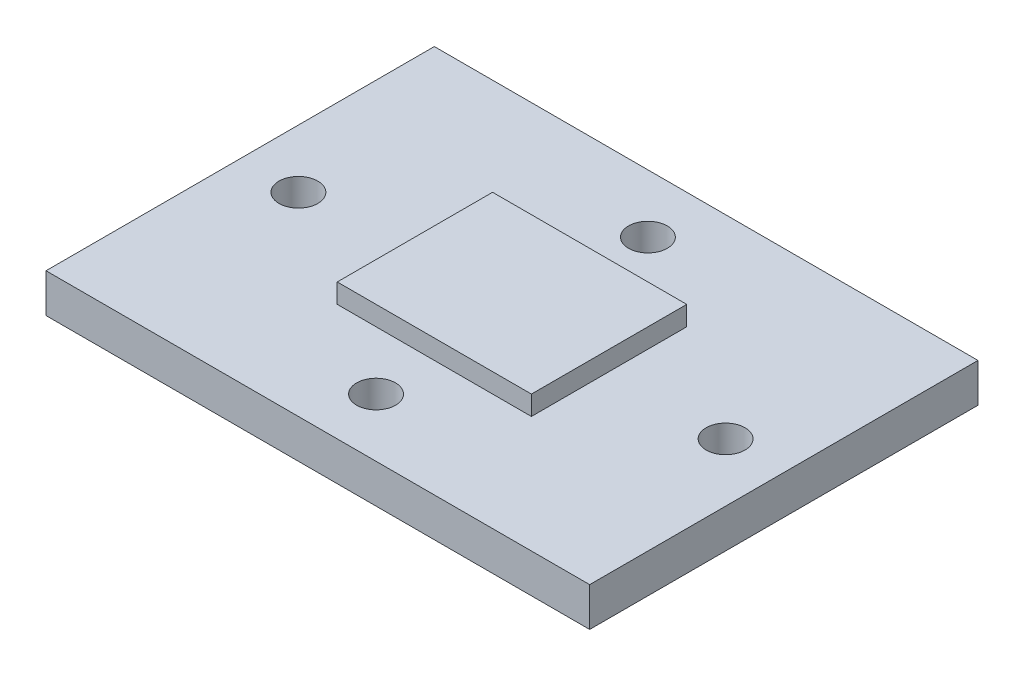
from build123d import *

# Parameters (mm, degrees)
SKETCH_1_W      = 140
SKETCH_1_H      = 100
SKETCH_1_R      = 5
EXTRUDE_1_DEPTH = 10
SKETCH_5_W      = 50
SKETCH_5_H      = 40
EXTRUDE_2_DEPTH = 5


with BuildPart() as part:
    # 草图1 → 凸台-拉伸1 (new body)
    with BuildSketch(Plane(origin=(0, 646, 0), x_dir=(1, 0, 0), z_dir=(0, 1, 0))):
        with Locations((-510.539921299, 175.104414428)):
            Rectangle(SKETCH_1_W, SKETCH_1_H)
        with Locations(Location((-565.539921299, 175.104414428, 0), (0, 0, 270))):
            Circle(SKETCH_1_R, mode=Mode.SUBTRACT)
        with Locations(Location((-510.539921299, 210.104414428, 0), (0, 0, 270))):
            Circle(SKETCH_1_R, mode=Mode.SUBTRACT)
        with Locations(Location((-510.539921299, 140.104414428, 0), (0, 0, 270))):
            Circle(SKETCH_1_R, mode=Mode.SUBTRACT)
        with Locations(Location((-455.539921299, 175.104414428, 0), (0, 0, 270))):
            Circle(SKETCH_1_R, mode=Mode.SUBTRACT)
    extrude(amount=EXTRUDE_1_DEPTH)

    # 草图5 → 凸台-拉伸2 (add)
    with BuildSketch(Plane(origin=(0, 656, 0), x_dir=(1, 0, 0), z_dir=(0, 1, 0))):
        with Locations((-510.539921299, 175.104414428)):
            Rectangle(SKETCH_5_W, SKETCH_5_H)
    extrude(amount=EXTRUDE_2_DEPTH)


solid = part.part
